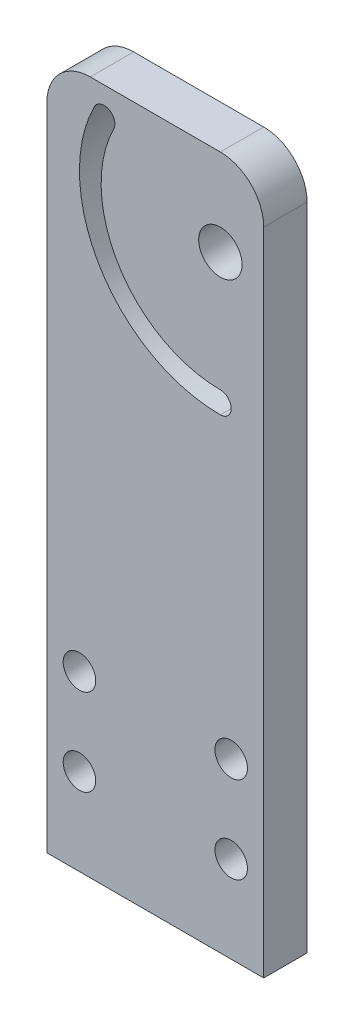
from build123d import *

# Parameters (mm, degrees)
SKETCH1_W           = 31.75
SKETCH1_H           = 101.6
SKETCH1_R           = 3.175
BOSS_EXTRUDE1_DEPTH = 6.35
SKETCH2_R           = 2.38125
CUT_EXTRUDE1_DEPTH  = 107.634633211
FILLET1_R           = 6.35


with BuildPart() as part:
    # Sketch1 → Boss-Extrude1 (new body)
    with BuildSketch(Plane.XY):
        with Locations((15.875, 50.8)):
            Rectangle(SKETCH1_W, SKETCH1_H)
        with Locations((25.4, 88.9)):
            Circle(SKETCH1_R, mode=Mode.SUBTRACT)
        with BuildLine():
            ThreePointArc((6.941258846, 98.129370577), (7.844693943, 78.050224174), (25.4, 68.2625))
            ThreePointArc((25.4, 68.2625), (26.9875, 69.85), (25.4, 71.4375))
            ThreePointArc((25.4, 71.4375), (10.545510259, 79.719420455), (9.781065177, 96.709467411))
            ThreePointArc((9.781065177, 96.709467411), (9.071113594, 98.83932216), (6.941258846, 98.129370577))
        make_face(mode=Mode.SUBTRACT)
    extrude(amount=BOSS_EXTRUDE1_DEPTH)

    # Sketch2 → Cut-Extrude1 (cut, through all)
    with BuildSketch(Plane.XY.offset(6.35)):
        with Locations((4.7625, 25.4)):
            Circle(SKETCH2_R)
        with Locations((26.9875, 25.4)):
            Circle(SKETCH2_R)
        with Locations((4.7625, 12.7)):
            Circle(SKETCH2_R)
        with Locations((26.9875, 12.7)):
            Circle(SKETCH2_R)
    extrude(amount=-CUT_EXTRUDE1_DEPTH, mode=Mode.SUBTRACT)

    # Fillet1
    fillet1_edges = [part.edges().sort_by_distance(p)[0] for p in [
        (0, 101.6, 3.175),
        (31.75, 101.6, 3.175),
    ]]
    fillet(fillet1_edges, radius=FILLET1_R)


solid = part.part
